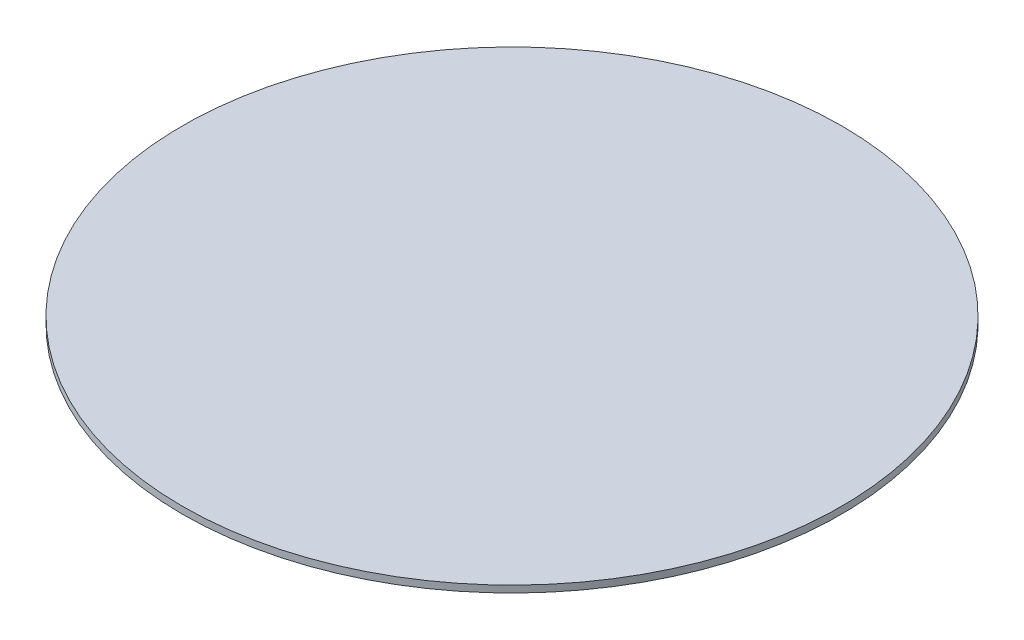
from build123d import *

# Parameters (mm, degrees)
SKETCH1_R           = 95.25
BOSS_EXTRUDE1_DEPTH = 1.984375


with BuildPart() as part:
    # Sketch1 → Boss-Extrude1 (new body)
    with BuildSketch(Plane(origin=(0, 0, 0), x_dir=(1, 0, 0), z_dir=(0, 1, 0))):
        with Locations(Location((0, 0, 0), (0, 0, 270))):
            Circle(SKETCH1_R)
    extrude(amount=BOSS_EXTRUDE1_DEPTH)


solid = part.part
